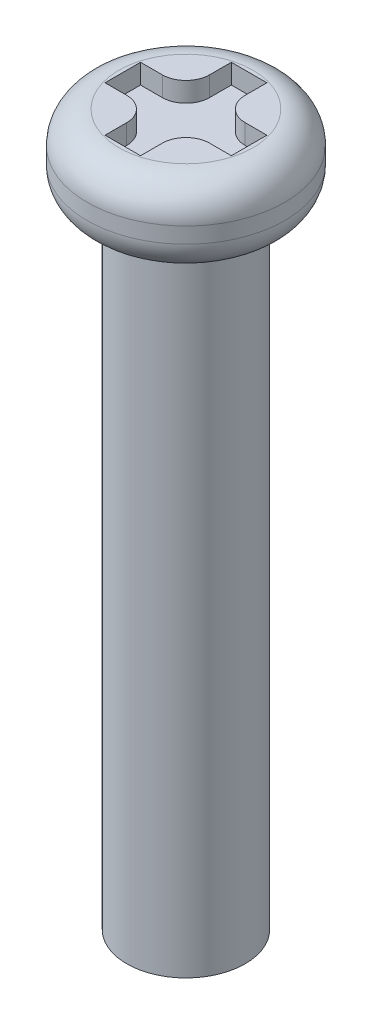
from build123d import *

# Parameters (mm, degrees)
FILLET2_R           = 0.8
SKETCH3_W           = 0.9
SKETCH3_H           = 3.2
CUT_EXTRUDE1_DEPTH  = 0.5
SKETCH4_W           = 3.2
SKETCH4_H           = 0.9
CUT_EXTRUDE2_DEPTH  = 4.840572939
FILLET1_R           = 0.6
SKETCH2_R           = 1.5
BOSS_EXTRUDE1_DEPTH = 16


with BuildPart() as part:
    # Sketch1 → Revolve1 (revolve)
    with BuildSketch(Plane(origin=(0, 0, 0), x_dir=(0, 0, -1), z_dir=(1, 0, 0))):
        with BuildLine():
            Line((0, 2), (0, 0))
            Line((0, 0), (2.5, 0))
            ThreePointArc((2.5, 0), (1.914213562, 1.414213562), (0.5, 2))
            Line((0.5, 2), (0, 2))
        make_face()
        with BuildLine():
            ThreePointArc((0.5, 2), (1.914213562, 1.414213562), (2.5, 0))
            Line((2.5, 0), (2.5, 2))
            Line((2.5, 2), (0.5, 2))
        make_face()
    revolve(axis=Axis((0, 0, 0), (0, 1, 0)))

    # Fillet2
    fillet2_edges = [part.edges().sort_by_distance(p)[0] for p in [
        (0, 2, 2.5),
        (0, 0, 2.5),
    ]]
    fillet(fillet2_edges, radius=FILLET2_R)

    # Sketch3 → Cut-Extrude1 (cut)
    with BuildSketch(Plane(origin=(0, 2, 0), x_dir=(1, 0, 0), z_dir=(0, 1, 0))):
        Rectangle(SKETCH3_W, SKETCH3_H)
    extrude(amount=-CUT_EXTRUDE1_DEPTH, mode=Mode.SUBTRACT)

    # Sketch4 → Cut-Extrude2 (cut, through all)
    with BuildSketch(Plane(origin=(0, 1.5, 0), x_dir=(1, 0, 0), z_dir=(0, 1, 0))):
        Rectangle(SKETCH4_W, SKETCH4_H)
    extrude(amount=CUT_EXTRUDE2_DEPTH, mode=Mode.SUBTRACT)

    # Fillet1
    fillet1_edges = [part.edges().sort_by_distance(p)[0] for p in [
        (0.45, 1.75, -0.45),
        (0.45, 1.75, 0.45),
        (-0.45, 1.75, -0.45),
        (-0.45, 1.75, 0.45),
    ]]
    fillet(fillet1_edges, radius=FILLET1_R)

    # Sketch2 → Boss-Extrude1 (add)
    with BuildSketch(Plane.XZ):
        with Locations(Location((0, 0, 0), (0, 0, 270))):
            Circle(SKETCH2_R)
    extrude(amount=BOSS_EXTRUDE1_DEPTH)


solid = part.part
